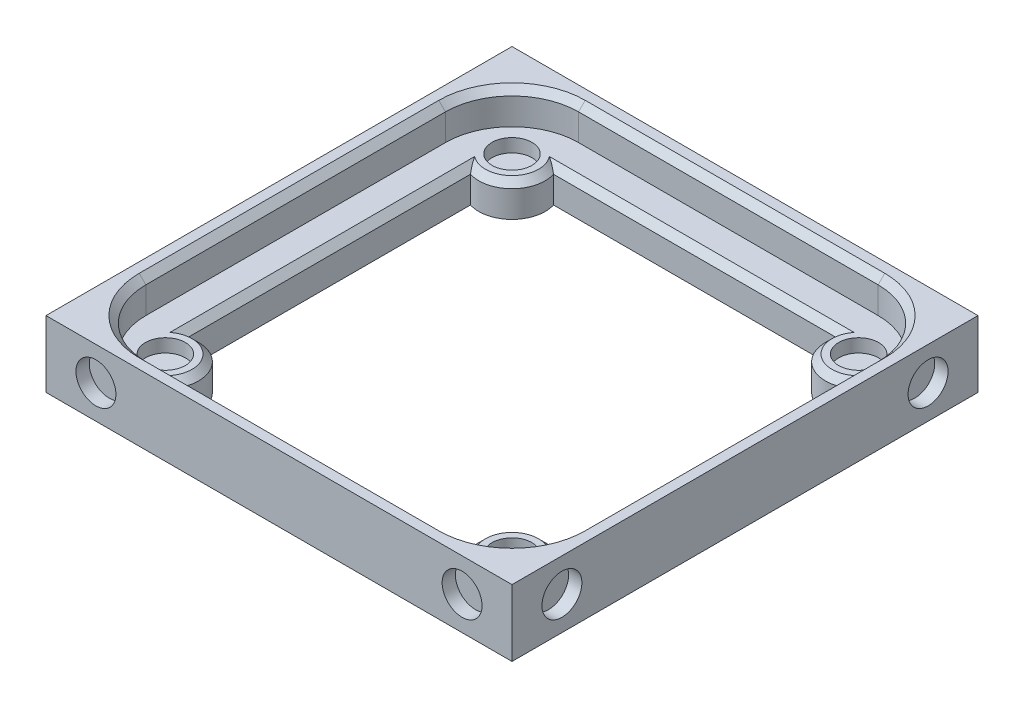
from build123d import *

# Parameters (mm, degrees)
SKETCH1_W           = 70
SKETCH1_H           = 70
BOSS_EXTRUDE2_DEPTH = 7
CUT_EXTRUDE1_DEPTH  = 5
SKETCH9_W           = 70
SKETCH9_H           = 70
BOSS_EXTRUDE3_DEPTH = 5
CUT_EXTRUDE11_DEPTH = 100.242128151
SKETCH21_R          = 3
CUT_EXTRUDE12_DEPTH = 2
CHAMFER3_SIZE       = 1
CUT_EXTRUDE13_START = -2
SKETCH22_W          = 70
SKETCH22_H          = 70
CUT_EXTRUDE13_DEPTH = 2
SKETCH27_R          = 3
CUT_EXTRUDE27_DEPTH = 2
SKETCH28_R          = 3
CUT_EXTRUDE28_DEPTH = 2


with BuildPart() as part:
    # Sketch1 → Boss-Extrude2 (new body)
    with BuildSketch(Plane(origin=(0, 0, 0), x_dir=(1, 0, 0), z_dir=(0, 1, 0))):
        with Locations((35, 35)):
            Rectangle(SKETCH1_W, SKETCH1_H)
    extrude(amount=BOSS_EXTRUDE2_DEPTH)

    # Sketch3 → Cut-Extrude1 (cut)
    with BuildSketch(Plane(origin=(0, 7, 0), x_dir=(1, 0, 0), z_dir=(0, 1, 0))):
        with BuildLine():
            Line((2.5, 57.5), (2.5, 12.5))
            ThreePointArc((2.5, 12.5), (5.428932188, 5.428932188), (12.5, 2.5))
            Line((12.5, 2.5), (57.5, 2.5))
            ThreePointArc((57.5, 2.5), (64.571067812, 5.428932188), (67.5, 12.5))
            Line((67.5, 12.5), (67.5, 57.5))
            ThreePointArc((67.5, 57.5), (64.571067812, 64.571067812), (57.5, 67.5))
            Line((57.5, 67.5), (12.5, 67.5))
            ThreePointArc((12.5, 67.5), (5.428932188, 64.571067812), (2.5, 57.5))
        make_face()
    extrude(amount=-CUT_EXTRUDE1_DEPTH, mode=Mode.SUBTRACT)

    # Sketch9 → Boss-Extrude3 (add)
    with BuildSketch(Plane.XZ):
        with Locations((35, -35)):
            Rectangle(SKETCH9_W, SKETCH9_H)
    extrude(amount=BOSS_EXTRUDE3_DEPTH)

    # Sketch20 → Cut-Extrude11 (cut, through all)
    with BuildSketch(Plane(origin=(0, 2, 0), x_dir=(1, 0, 0), z_dir=(0, 1, 0))):
        with BuildLine():
            Line((13.745191882, 7.5), (56.254808118, 7.5))
            ThreePointArc((56.254808118, 7.5), (57.5, 12.5), (62.5, 13.745191882))
            Line((62.5, 13.745191882), (62.5, 56.254808118))
            ThreePointArc((62.5, 56.254808118), (57.5, 57.5), (56.254808118, 62.5))
            Line((56.254808118, 62.5), (13.745191882, 62.5))
            ThreePointArc((13.745191882, 62.5), (12.5, 57.5), (7.5, 56.254808118))
            Line((7.5, 56.254808118), (7.5, 13.745191882))
            ThreePointArc((7.5, 13.745191882), (12.5, 12.5), (13.745191882, 7.5))
        make_face()
    extrude(amount=-CUT_EXTRUDE11_DEPTH, mode=Mode.SUBTRACT)

    # Sketch21 → Cut-Extrude12 (cut)
    with BuildSketch(Plane(origin=(0, 2, 0), x_dir=(1, 0, 0), z_dir=(0, 1, 0))):
        with Locations(Location((8.964466094, 61.035533906, 0), (0, 0, 270))):
            Circle(SKETCH21_R)
        with Locations(Location((61.035533906, 61.035533906, 0), (0, 0, 270))):
            Circle(SKETCH21_R)
        with Locations(Location((61.035533906, 8.964466094, 0), (0, 0, 270))):
            Circle(SKETCH21_R)
        with Locations(Location((8.964466094, 8.964466094, 0), (0, 0, 270))):
            Circle(SKETCH21_R)
    extrude(amount=-CUT_EXTRUDE12_DEPTH, mode=Mode.SUBTRACT)

    # Chamfer3
    chamfer3_edges = [part.edges().sort_by_distance(p)[0] for p in [
        (5.428932188, 7, -5.428932188),
        (35, 7, -2.5),
        (64.571067812, 7, -5.428932188),
        (67.5, 7, -35),
        (64.571067812, 7, -64.571067812),
        (35, 7, -67.5),
        (5.428932188, 7, -64.571067812),
        (2.5, 7, -35),
        (12.5, 2, -12.5),
        (12.5, 2, -57.5),
        (57.5, 2, -57.5),
        (57.5, 2, -12.5),
        (35, 2, -7.5),
        (62.5, 2, -35),
        (35, 2, -62.5),
        (7.5, 2, -35),
    ]]
    chamfer(chamfer3_edges, length=CHAMFER3_SIZE)

    # Sketch22 → Cut-Extrude13 (cut)
    with BuildSketch(Plane.XZ.offset(5).offset(CUT_EXTRUDE13_START)):
        with Locations((35, -35)):
            Rectangle(SKETCH22_W, SKETCH22_H)
        with BuildLine():
            Line((7.5, -13.745191882), (7.5, -56.254808118))
            ThreePointArc((7.5, -56.254808118), (12.5, -57.5), (13.745191882, -62.5))
            Line((13.745191882, -62.5), (56.254808118, -62.5))
            ThreePointArc((56.254808118, -62.5), (57.5, -57.5), (62.5, -56.254808118))
            Line((62.5, -56.254808118), (62.5, -13.745191882))
            ThreePointArc((62.5, -13.745191882), (57.5, -12.5), (56.254808118, -7.5))
            Line((56.254808118, -7.5), (13.745191882, -7.5))
            ThreePointArc((13.745191882, -7.5), (12.5, -12.5), (7.5, -13.745191882))
        make_face(mode=Mode.SUBTRACT)
    extrude(amount=CUT_EXTRUDE13_DEPTH, mode=Mode.SUBTRACT)

    # Sketch27 → Cut-Extrude27 (cut)
    with BuildSketch(Plane.ZY):
        with Locations((-62.5, 2)):
            Circle(SKETCH27_R)
        with Locations((-7.5, 2)):
            Circle(SKETCH27_R)
    cut_extrude27 = extrude(amount=-CUT_EXTRUDE27_DEPTH, mode=Mode.SUBTRACT)

    # Mirror4: Cut-Extrude27 across plane
    add(cut_extrude27.mirror(Plane.ZY.offset(-35)), mode=Mode.SUBTRACT)

    # Sketch28 → Cut-Extrude28 (cut)
    with BuildSketch(Plane.XY):
        with Locations((7.5, 2)):
            Circle(SKETCH28_R)
        with Locations((62.5, 2)):
            Circle(SKETCH28_R)
    cut_extrude28 = extrude(amount=-CUT_EXTRUDE28_DEPTH, mode=Mode.SUBTRACT)

    # Mirror5: Cut-Extrude28 across plane
    add(cut_extrude28.mirror(Plane.XY.offset(-35)), mode=Mode.SUBTRACT)


solid = part.part
